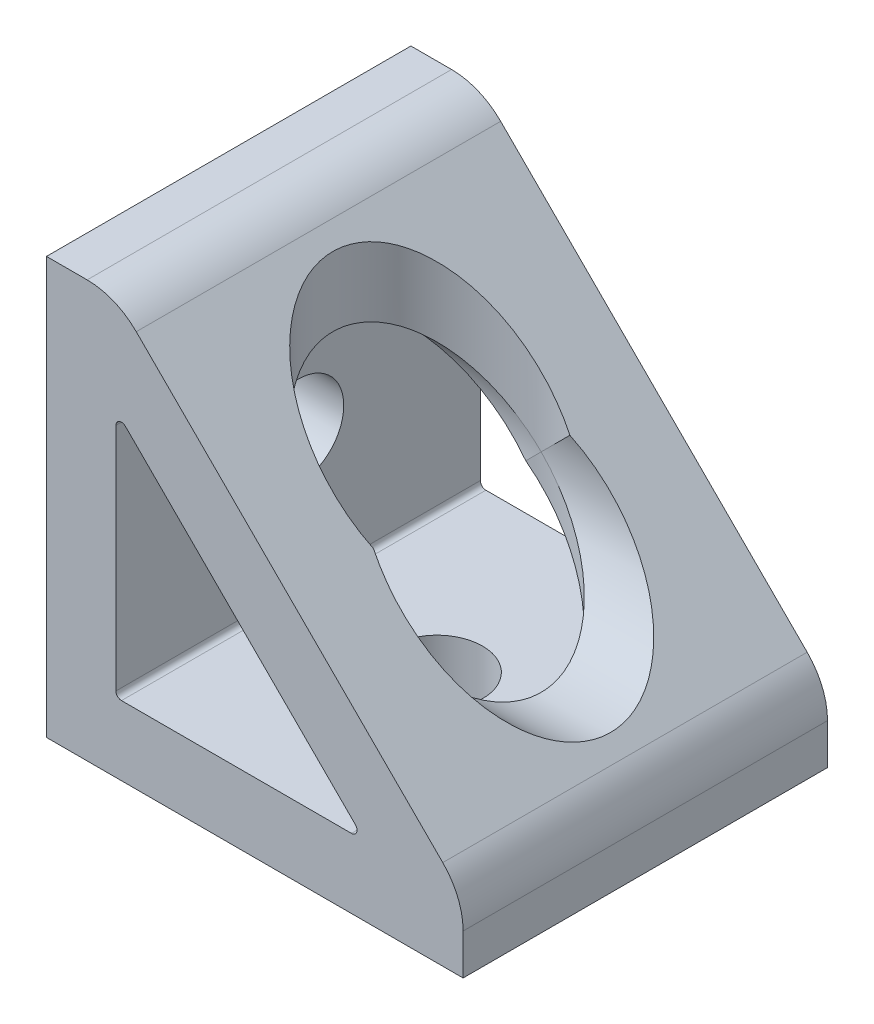
from build123d import *

# Parameters (mm, degrees)
BOSS_EXTRUDE2_DEPTH = 16.6624
CUT_EXTRUDE1_REACH  = 58.399
SKETCH3_R           = 4.16941
SKETCH4_R           = 9.525
CUT_EXTRUDE2_DEPTH  = 36.068
CUT_EXTRUDE3_REACH  = 58.399
SKETCH5_R           = 4.1656
SKETCH6_R           = 9.525
CUT_EXTRUDE4_DEPTH  = 36.068


with BuildPart() as part:
    # Sketch2 → Boss-Extrude2 (new, symmetric)
    with BuildSketch(Plane.XY):
        with BuildLine():
            Line((0, 38.1), (0, 0))
            Line((0, 0), (38.1, 0))
            Line((38.1, 0), (38.1, 3.719743879))
            ThreePointArc((38.1, 3.719743879), (37.616635031, 6.149783674), (36.240128061, 8.209871939))
            Line((36.240128061, 8.209871939), (8.209871939, 36.240128061))
            ThreePointArc((8.209871939, 36.240128061), (6.149783674, 37.616635031), (3.719743879, 38.1))
            Line((3.719743879, 38.1), (0, 38.1))
        make_face()
        with BuildLine():
            Line((6.35, 27.893323389), (6.35, 6.858))
            ThreePointArc((6.35, 6.858), (6.498789755, 6.498789755), (6.858, 6.35))
            Line((6.858, 6.35), (27.893323389, 6.35))
            ThreePointArc((27.893323389, 6.35), (28.362654192, 6.663596816), (28.252533634, 7.217210245))
            Line((28.252533634, 7.217210245), (7.217210245, 28.252533634))
            ThreePointArc((7.217210245, 28.252533634), (6.663596816, 28.362654192), (6.35, 27.893323389))
        make_face(mode=Mode.SUBTRACT)
    extrude(amount=BOSS_EXTRUDE2_DEPTH, both=True)

    # Sketch3 → Cut-Extrude1 (cut, up to next)
    with BuildSketch(Plane.ZY, mode=Mode.PRIVATE) as cut_extrude1_sk1:
        with Locations(Location((0, 19.05, 0), (0, 0, 270))):
            Circle(SKETCH3_R)
    cut_extrude1_tool1 = extrude(cut_extrude1_sk1.sketch, amount=-CUT_EXTRUDE1_REACH, mode=Mode.PRIVATE) & part.part
    add(cut_extrude1_tool1.solids().sort_by_distance((0, 19.05, 0))[0], mode=Mode.SUBTRACT)

    # Sketch4 → Cut-Extrude2 (cut)
    with BuildSketch(Plane(origin=(6.35, 0, 0), x_dir=(0, 0, -1), z_dir=(1, 0, 0))):
        with Locations(Location((0, 19.05, 0), (0, 0, 111.808163998))):
            Circle(SKETCH4_R)
    extrude(amount=CUT_EXTRUDE2_DEPTH, mode=Mode.SUBTRACT)

    # Sketch5 → Cut-Extrude3 (cut, up to next)
    with BuildSketch(Plane.XZ, mode=Mode.PRIVATE) as cut_extrude3_sk1:
        with Locations(Location((19.05, 0, 0), (0, 0, 270))):
            Circle(SKETCH5_R)
    cut_extrude3_tool1 = extrude(cut_extrude3_sk1.sketch, amount=-CUT_EXTRUDE3_REACH, mode=Mode.PRIVATE) & part.part
    add(cut_extrude3_tool1.solids().sort_by_distance((19.05, 0, 0))[0], mode=Mode.SUBTRACT)

    # Sketch6 → Cut-Extrude4 (cut)
    with BuildSketch(Plane(origin=(0, 6.35, 0), x_dir=(1, 0, 0), z_dir=(0, 1, 0))):
        with Locations((19.05, 0)):
            Circle(SKETCH6_R)
    extrude(amount=CUT_EXTRUDE4_DEPTH, mode=Mode.SUBTRACT)


solid = part.part
